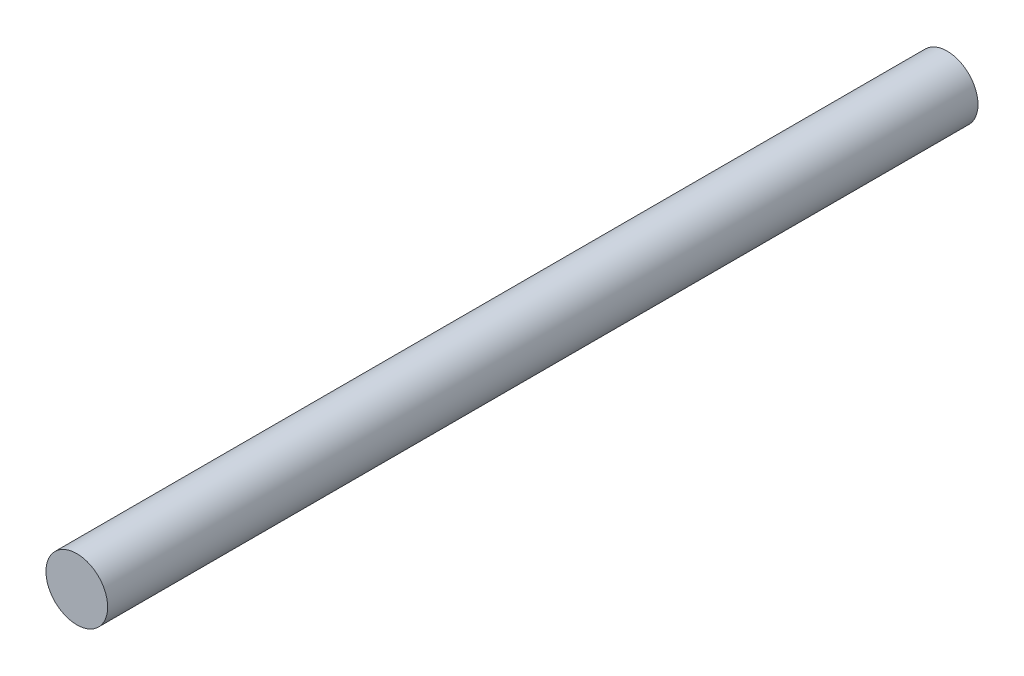
from build123d import *

# Parameters (mm, degrees)
SKICA1_R                = 1
P_IDAT_VYSUNUT_M1_DEPTH = 28.2


with BuildPart() as part:
    # Skica1 → Přidat vysunutím1 (new body)
    with BuildSketch(Plane.XY):
        Circle(SKICA1_R)
    extrude(amount=P_IDAT_VYSUNUT_M1_DEPTH)


solid = part.part
